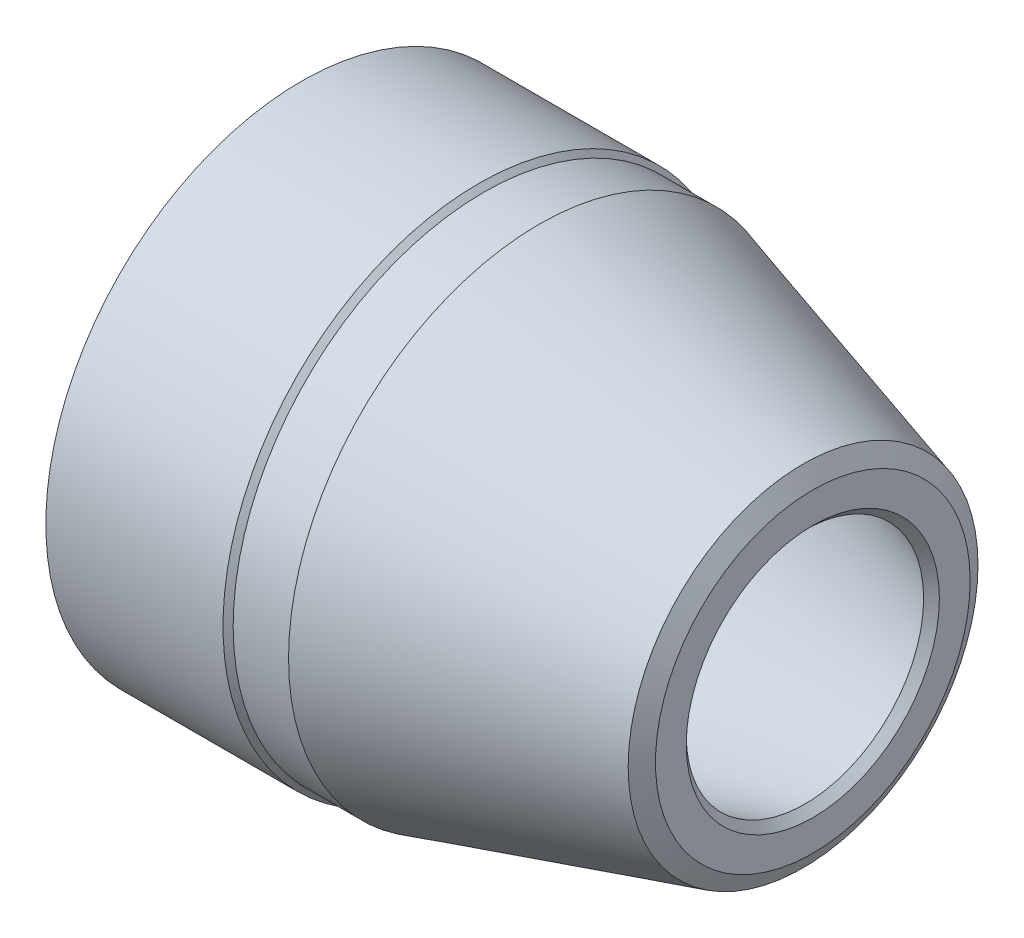
from build123d import *
from OCP.BRepFilletAPI import BRepFilletAPI_MakeChamfer

# Parameters (mm, degrees)
CHANFREIN1_SIZE    = 1
CHANFREIN1_SIZE2   = 0.808473415
CHANFREIN1_SIZE2_2 = 1.458524649


with BuildPart() as part:
    # Esquisse1 → Révolution1 (revolve)
    with BuildSketch(Plane.XY, mode=Mode.PRIVATE) as r_volution1_sk:
        Polygon((0, 21.5), (0, 25.25), (17.5, 25.25), (18, 24.75), (23.47253806, 24.75), (50.5, 17), (50.5, 11.5), (17.369562784, 21), (15.869562784, 22.5), (7, 22.5), (7, 21.5), align=None)
    revolve(r_volution1_sk.sketch.rotate(Axis((0, 0, 0), (-1, 0, 0)), 90), axis=Axis((0, 0, 0), (-1, 0, 0)))

    # Chanfrein1: one chamfer whose edges measure the first distance from different faces: ONE call of the kernel's chamfer builder (chamfer() names one face for all edges)
    chanfrein1_edges_1 = [part.edges().sort_by_distance(p)[0] for p in [
        (0, 0, 21.5),
    ]]
    chanfrein1_edges_2 = [part.edges().sort_by_distance(p)[0] for p in [
        (50.5, 0, 11.5),
    ]]
    chanfrein1_side_2 = [part.faces().sort_by_distance(p)[0] for p in [
        (50.5, 0, 16.519167389),
    ]]
    chanfrein1_edges_3 = [part.edges().sort_by_distance(p)[0] for p in [
        (50.5, 0, 17),
    ]]
    chanfrein1_side_3 = [part.faces().sort_by_distance(p)[0] for p in [
        (36.98626903, 0, 20.875),
    ]]
    chanfrein1 = BRepFilletAPI_MakeChamfer(part.part.solid().wrapped)
    for e in chanfrein1_edges_1:
        chanfrein1.Add(CHANFREIN1_SIZE, e.wrapped)
    for e in chanfrein1_edges_2:
        chanfrein1.Add(CHANFREIN1_SIZE, CHANFREIN1_SIZE2, e.wrapped, chanfrein1_side_2[0].wrapped)  # the first distance lies on this face
    for e in chanfrein1_edges_3:
        chanfrein1.Add(CHANFREIN1_SIZE, CHANFREIN1_SIZE2_2, e.wrapped, chanfrein1_side_3[0].wrapped)  # the first distance lies on this face
    add(Compound.cast(chanfrein1.Shape()), mode=Mode.REPLACE)


solid = part.part
